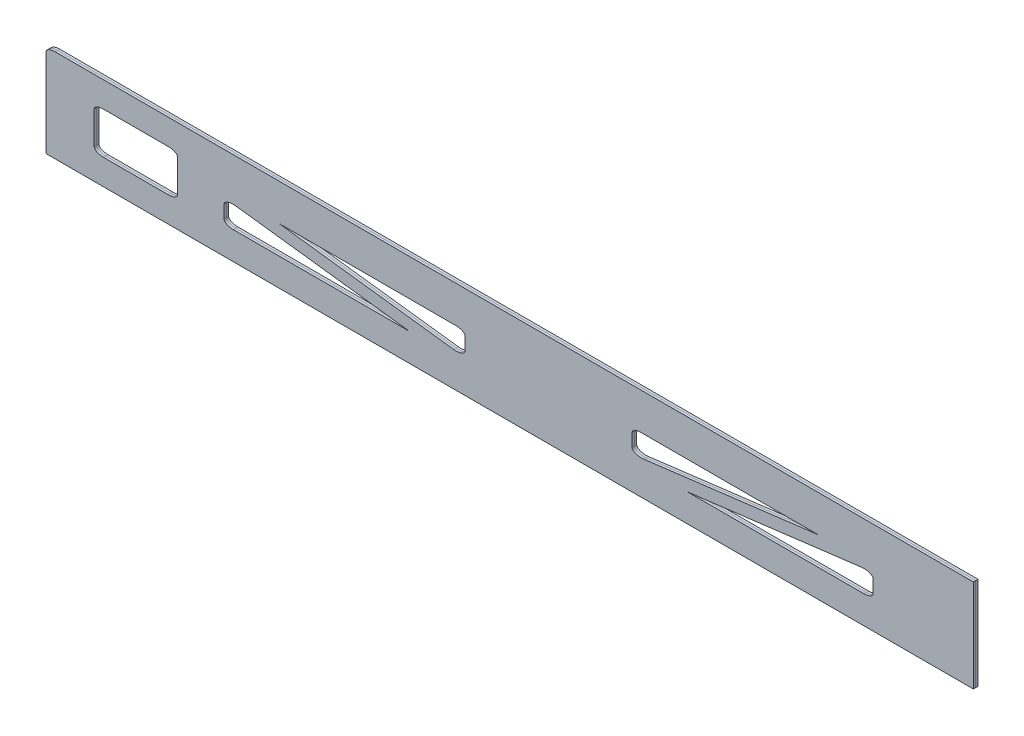
from build123d import *

# Parameters (mm, degrees)
SKETCH1_W               = 9
SKETCH1_H               = 9
SKETCH1_W_2             = 3
SKETCH1_H_2             = 1.5
BOSS_EXTRUDE1_DEPTH     = 0.5
FILLET1_R               = 10
FILLET3_R               = 1
SCALE2_SCALE_X          = 2
SCALE2_SCALE_Y          = 1
SCALE2_SCALE_Z          = 1
CUT_EXTRUDE2_DEPTH      = 301.627198821
CUT_EXTRUDE2_DEPTH_BACK = 301.627198821
SKETCH3_W               = 200
SKETCH3_H               = 40.084722174


with BuildPart() as part:
    # Sketch1 → Boss-Extrude1 (new, symmetric)
    with BuildSketch(Plane.XY):
        with BuildLine():
            Line((-200, 10), (-200, 20))
            Line((-200, 20), (-12.686273665, 20))
            ThreePointArc((-12.686273665, 20), (-6.83279553, 18.787212337), (-1.943060243, 15.348528137))
            Line((-1.943060243, 15.348528137), (0, 10))
            Line((0, 10), (0, 0))
            Line((0, 0), (-10, 0))
            Line((-10, 0), (-200, 0))
            Line((-200, 0), (-200, 10))
        make_face()
        Polygon((-180.8, 11), (-180.8, 6), (-160.8, 6), align=None, mode=Mode.SUBTRACT)
        with Locations((-190.3, 10)):
            Rectangle(SKETCH1_W, SKETCH1_H, mode=Mode.SUBTRACT)
        Polygon((-154.8, 7.076941016), (-154.8, 12.076941016), (-174.8, 12.076941016), align=None, mode=Mode.SUBTRACT)
        Polygon((-130.8, 6), (-110.8, 11), (-110.8, 6), align=None, mode=Mode.SUBTRACT)
        Polygon((-136.8, 7.076941016), (-136.8, 12.076941016), (-116.8, 12.076941016), align=None, mode=Mode.SUBTRACT)
        with BuildLine():
            Line((-95.102943725, 12.697056275), (-89.021825407, 6.615937957))
            ThreePointArc((-89.021825407, 6.615937957), (-89.021825407, 4.918881682), (-90.718881682, 4.918881682))
            Line((-90.718881682, 4.918881682), (-96.8, 11))
            ThreePointArc((-96.8, 11), (-96.8, 12.697056275), (-95.102943725, 12.697056275))
        make_face(mode=Mode.SUBTRACT)
        with BuildLine():
            Line((-93.794617613, 16.197056275), (-89.127712857, 11.530151519))
            ThreePointArc((-89.127712857, 11.530151519), (-89.127712857, 9.833095244), (-90.824769132, 9.833095244))
            Line((-90.824769132, 9.833095244), (-95.491673888, 14.5))
            ThreePointArc((-95.491673888, 14.5), (-95.491673888, 16.197056275), (-93.794617613, 16.197056275))
        make_face(mode=Mode.SUBTRACT)
        with Locations((-89.794617613, 18.25)):
            Rectangle(SKETCH1_W_2, SKETCH1_H_2, mode=Mode.SUBTRACT)
        with Locations((-62.460808101, 18.25)):
            Rectangle(SKETCH1_W_2, SKETCH1_H_2, mode=Mode.SUBTRACT)
        with BuildLine():
            Line((-58.460808101, 16.197056275), (-63.127712857, 11.530151519))
            ThreePointArc((-63.127712857, 11.530151519), (-63.127712857, 9.833095244), (-61.430656582, 9.833095244))
            Line((-61.430656582, 9.833095244), (-56.763751827, 14.5))
            ThreePointArc((-56.763751827, 14.5), (-56.763751827, 16.197056275), (-58.460808101, 16.197056275))
        make_face(mode=Mode.SUBTRACT)
        with BuildLine():
            Line((-57.152481989, 12.697056275), (-63.233600308, 6.615937957))
            ThreePointArc((-63.233600308, 6.615937957), (-63.233600308, 4.918881682), (-61.536544033, 4.918881682))
            Line((-61.536544033, 4.918881682), (-55.455425715, 11))
            ThreePointArc((-55.455425715, 11), (-55.455425715, 12.697056275), (-57.152481989, 12.697056275))
        make_face(mode=Mode.SUBTRACT)
        Polygon((-25.2, 12.076941016), (-45.2, 7.076941016), (-45.2, 12.076941016), align=None, mode=Mode.SUBTRACT)
        Polygon((-39.2, 6), (-19.2, 11), (-19.2, 6), align=None, mode=Mode.SUBTRACT)
        with BuildLine():
            Line((-17.321963125, 16.390064684), (-14.260022427, 12.437278431))
            ThreePointArc((-14.260022427, 12.437278431), (-14.47382536, 10.753743963), (-16.157359828, 10.967546896))
            Line((-16.157359828, 10.967546896), (-19.219300527, 14.920333149))
            ThreePointArc((-19.219300527, 14.920333149), (-19.005497594, 16.603867617), (-17.321963125, 16.390064684))
        make_face(mode=Mode.SUBTRACT)
        with BuildLine():
            Line((-12.321963125, 14.907009966), (-9.260022427, 10.954223713))
            ThreePointArc((-9.260022427, 10.954223713), (-9.47382536, 9.270689245), (-11.157359828, 9.484492178))
            Line((-11.157359828, 9.484492178), (-14.219300527, 13.437278431))
            ThreePointArc((-14.219300527, 13.437278431), (-14.005497594, 15.120812899), (-12.321963125, 14.907009966))
        make_face(mode=Mode.SUBTRACT)
        with BuildLine():
            Line((-7.321963125, 15.376741501), (-4.260022427, 11.423955248))
            ThreePointArc((-4.260022427, 11.423955248), (-4.47382536, 9.74042078), (-6.157359828, 9.954223713))
            Line((-6.157359828, 9.954223713), (-9.219300527, 13.907009966))
            ThreePointArc((-9.219300527, 13.907009966), (-9.005497594, 15.590544434), (-7.321963125, 15.376741501))
        make_face(mode=Mode.SUBTRACT)
    extrude(amount=BOSS_EXTRUDE1_DEPTH, both=True)

    # Fillet1
    fillet1_edges = [part.edges().sort_by_distance(p)[0] for p in [
        (0, 10, 0),
        (-1.943060243, 15.348528137, 0),
    ]]
    fillet(fillet1_edges, radius=FILLET1_R)

    # Fillet3
    fillet3_edges = [part.edges().sort_by_distance(p)[0] for p in [
        (-200, 20, 0),
        (-154.8, 7.076941016, 0),
        (-154.8, 12.076941016, 0),
        (-180.8, 11, 0),
        (-180.8, 6, 0),
        (-194.8, 14.5, 0),
        (-194.8, 5.5, 0),
        (-185.8, 5.5, 0),
        (-185.8, 14.5, 0),
        (-110.8, 6, 0),
        (-110.8, 11, 0),
        (-136.8, 7.076941016, 0),
        (-136.8, 12.076941016, 0),
        (-45.2, 12.076941016, 0),
        (-45.2, 7.076941016, 0),
        (-19.2, 6, 0),
        (-19.2, 11, 0),
    ]]
    fillet(fillet3_edges, radius=FILLET3_R)


with BuildPart() as body_2:
    # Split1: the piece on the far side of the plane
    add(part.part)
    split(bisect_by=Plane.XY, keep=Keep.BOTTOM)


with BuildPart() as part_1:
    add(part.part)

    # Split1
    split(bisect_by=Plane.XY, keep=Keep.TOP)


with BuildPart() as part_2:
    # Scale2: scaled about (-100.04048172, 9.935687114, 0)
    add(part_1.part.scale((SCALE2_SCALE_X, SCALE2_SCALE_Y, SCALE2_SCALE_Z), about=(-100.04048172, 9.935687114, 0)))


with BuildPart() as body_2_1:
    # Scale2: scaled about (-100.04048172, 9.935687114, 0)
    add(body_2.part.scale((SCALE2_SCALE_X, SCALE2_SCALE_Y, SCALE2_SCALE_Z), about=(-100.04048172, 9.935687114, 0)))


with BuildPart() as cut_extrude2_tool:
    # Sketch3 → Cut-Extrude2 (new, two sides: drawn at the far end of the back side and taken through both)
    with BuildSketch(Plane.XY.offset(0.5).offset(-CUT_EXTRUDE2_DEPTH_BACK)):
        with Locations((0.04048172, 20.042361087)):
            Rectangle(SKETCH3_W, SKETCH3_H)
    extrude(amount=CUT_EXTRUDE2_DEPTH + CUT_EXTRUDE2_DEPTH_BACK)


with BuildPart() as part_3:
    add(part_2.part)

    # Cut-Extrude2: cut by cut_extrude2_tool
    add(cut_extrude2_tool.part, mode=Mode.SUBTRACT)


with BuildPart() as body_2_2:
    add(body_2_1.part)

    # Cut-Extrude2: cut by cut_extrude2_tool
    add(cut_extrude2_tool.part, mode=Mode.SUBTRACT)


solid = Compound([part_3.part, body_2_2.part])
